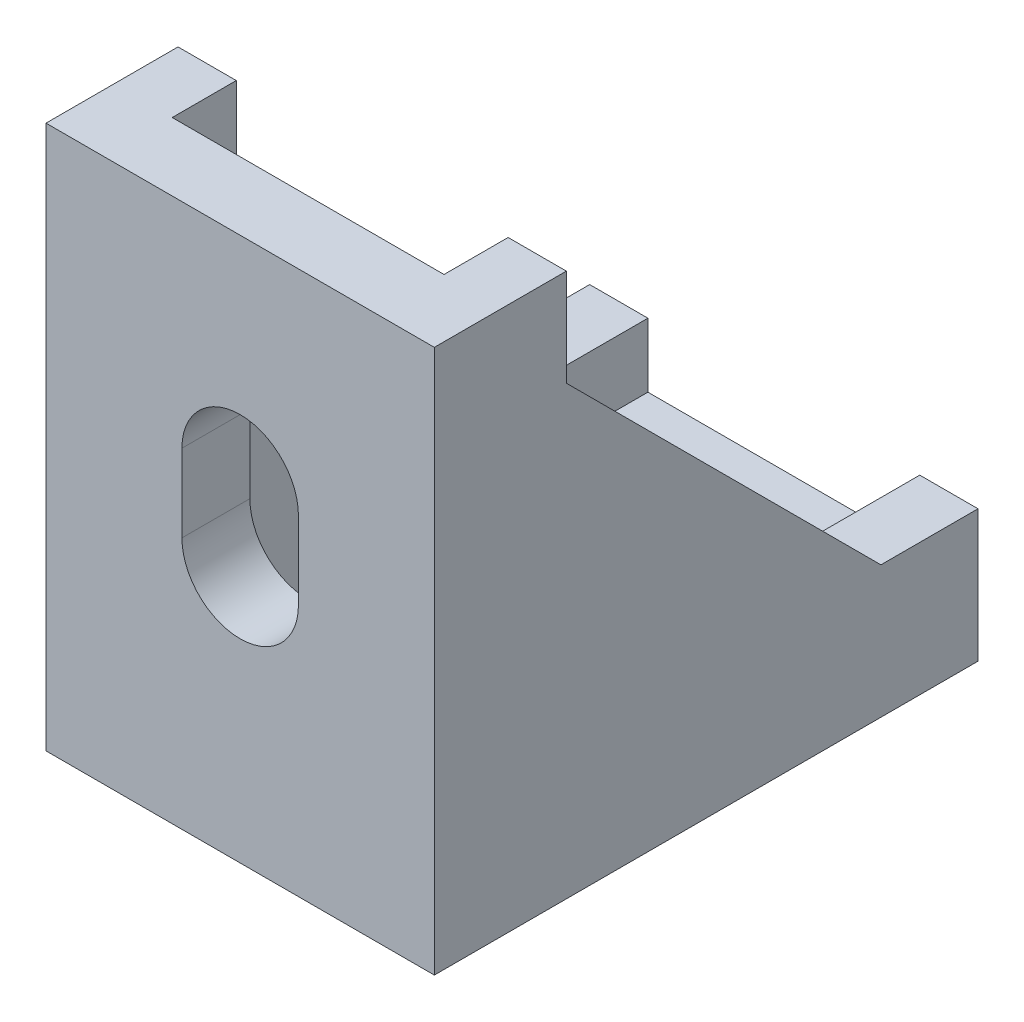
from build123d import *

# Parameters (mm, degrees)
SKETCH2_W           = 20
SKETCH2_H           = 28
BOSS_EXTRUDE1_DEPTH = 3.5
SKETCH3_W           = 20
SKETCH3_H           = 28
BOSS_EXTRUDE2_DEPTH = 3.5
BOSS_EXTRUDE3_DEPTH = 3
BOSS_EXTRUDE4_DEPTH = 3


with BuildPart() as part:
    # Sketch2 → Boss-Extrude1 (new body)
    with BuildSketch(Plane(origin=(0, 0, 0), x_dir=(1, 0, 0), z_dir=(0, 1, 0))):
        Rectangle(SKETCH2_W, SKETCH2_H)
        with BuildLine():
            Line((-3, -1), (-3, 3))
            ThreePointArc((-3, 3), (0, 6), (3, 3))
            Line((3, 3), (3, -1))
            ThreePointArc((3, -1), (0, -4), (-3, -1))
        make_face(mode=Mode.SUBTRACT)
    extrude(amount=BOSS_EXTRUDE1_DEPTH)

    # Sketch3 → Boss-Extrude2 (add)
    with BuildSketch(Plane.XY.offset(14)):
        with Locations((0, 14)):
            Rectangle(SKETCH3_W, SKETCH3_H)
        with BuildLine():
            Line((3, 17), (3, 13))
            ThreePointArc((3, 13), (0, 10), (-3, 13))
            Line((-3, 13), (-3, 17))
            ThreePointArc((-3, 17), (0, 20), (3, 17))
        make_face(mode=Mode.SUBTRACT)
    extrude(amount=-BOSS_EXTRUDE2_DEPTH)

    # Sketch4 → Boss-Extrude3 (add)
    with BuildSketch(Plane(origin=(10, 0, 0), x_dir=(0, 0, -1), z_dir=(1, 0, 0))):
        Polygon((-14, 0), (14, 0), (14, 6.8), (9, 6.8), (-7.2, 23), (-7.2, 28), (-14, 28), align=None)
    extrude(amount=-BOSS_EXTRUDE3_DEPTH)

    # Sketch5 → Boss-Extrude4 (add)
    with BuildSketch(Plane.ZY.offset(10)):
        Polygon((-14, 0), (14, 0), (14, 28), (7.2, 28), (7.2, 23), (-9, 6.8), (-14, 6.8), align=None)
    extrude(amount=-BOSS_EXTRUDE4_DEPTH)


solid = part.part
